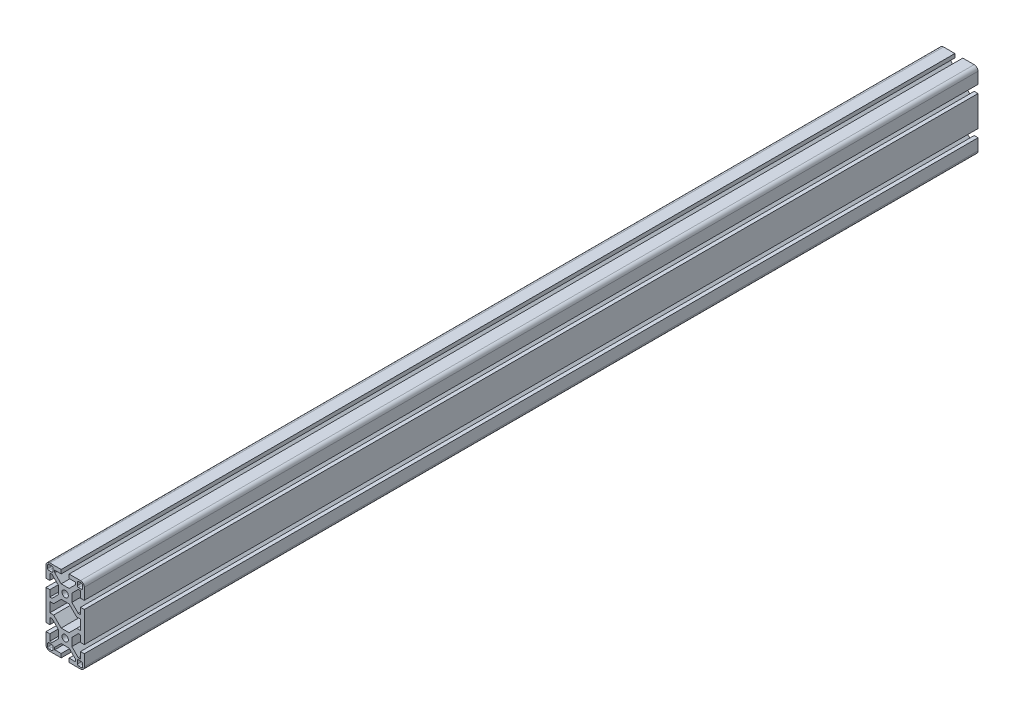
from build123d import *

# Parameters (mm, degrees)
SKETCH1_R                 = 2.45
BOSS_EXTRUDE1_DEPTH       = 700
SKETCH2_R                 = 3
CUT_EXTRUDE1_DEPTH        = 678.163200418
M6X1_0_TAPPED_HOLE1_D     = 5
M6X1_0_TAPPED_HOLE1_DEPTH = 28
M6X1_0_TAPPED_HOLE1_TIP   = 1.502151548
M6X1_0_TAPPED_HOLE2_D     = 5
M6X1_0_TAPPED_HOLE2_DEPTH = 28
M6X1_0_TAPPED_HOLE2_TIP   = 1.502151548


with BuildPart() as part:
    # Sketch1 → Boss-Extrude1 (new body)
    with BuildSketch(Plane.XY.offset(25)):
        with BuildLine():
            Line((10.271320344, -21.85), (12, -21.85))
            Line((12, -21.85), (12, -26.9))
            Line((12, -26.9), (15, -26.9))
            Line((15, -26.9), (15, -3.1))
            Line((15, -3.1), (12, -3.1))
            Line((12, -3.1), (12, -8.15))
            Line((12, -8.15), (10.271320344, -8.15))
            Line((10.271320344, -8.15), (5.25, -3.128679656))
            Line((5.25, -3.128679656), (5.25, 3.128679656))
            Line((5.25, 3.128679656), (10.271320344, 8.15))
            Line((10.271320344, 8.15), (12, 8.15))
            Line((12, 8.15), (12, 3.1))
            Line((12, 3.1), (15, 3.1))
            Line((15, 3.1), (15, 12))
            ThreePointArc((15, 12), (14.121320344, 14.121320344), (12, 15))
            Line((12, 15), (3.1, 15))
            Line((3.1, 15), (3.1, 12))
            Line((3.1, 12), (8.15, 12))
            Line((8.15, 12), (8.15, 10.271320344))
            Line((8.15, 10.271320344), (3.128679656, 5.25))
            Line((3.128679656, 5.25), (-3.128679656, 5.25))
            Line((-3.128679656, 5.25), (-8.15, 10.271320344))
            Line((-8.15, 10.271320344), (-8.15, 12))
            Line((-8.15, 12), (-3.1, 12))
            Line((-3.1, 12), (-3.1, 15))
            Line((-3.1, 15), (-12, 15))
            ThreePointArc((-12, 15), (-14.121320344, 14.121320344), (-15, 12))
            Line((-15, 12), (-15, 3.1))
            Line((-15, 3.1), (-12, 3.1))
            Line((-12, 3.1), (-12, 8.15))
            Line((-12, 8.15), (-10.271320344, 8.15))
            Line((-10.271320344, 8.15), (-5.25, 3.128679656))
            Line((-5.25, 3.128679656), (-5.25, -3.128679656))
            Line((-5.25, -3.128679656), (-10.271320344, -8.15))
            Line((-10.271320344, -8.15), (-12, -8.15))
            Line((-12, -8.15), (-12, -3.1))
            Line((-12, -3.1), (-15, -3.1))
            Line((-15, -3.1), (-15, -26.9))
            Line((-15, -26.9), (-12, -26.9))
            Line((-12, -26.9), (-12, -21.85))
            Line((-12, -21.85), (-10.271320344, -21.85))
            Line((-10.271320344, -21.85), (-5.25, -26.871320344))
            Line((-5.25, -26.871320344), (-5.25, -33.128679656))
            Line((-5.25, -33.128679656), (-10.271320344, -38.15))
            Line((-10.271320344, -38.15), (-12, -38.15))
            Line((-12, -38.15), (-12, -33.1))
            Line((-12, -33.1), (-15, -33.1))
            Line((-15, -33.1), (-15, -42))
            ThreePointArc((-15, -42), (-14.121320344, -44.121320344), (-12, -45))
            Line((-12, -45), (-3.1, -45))
            Line((-3.1, -45), (-3.1, -42))
            Line((-3.1, -42), (-8.15, -42))
            Line((-8.15, -42), (-8.15, -40.271320344))
            Line((-8.15, -40.271320344), (-3.128679656, -35.25))
            Line((-3.128679656, -35.25), (3.128679656, -35.25))
            Line((3.128679656, -35.25), (8.15, -40.271320344))
            Line((8.15, -40.271320344), (8.15, -42))
            Line((8.15, -42), (3.1, -42))
            Line((3.1, -42), (3.1, -45))
            Line((3.1, -45), (12, -45))
            ThreePointArc((12, -45), (14.121320344, -44.121320344), (15, -42))
            Line((15, -42), (15, -33.1))
            Line((15, -33.1), (12, -33.1))
            Line((12, -33.1), (12, -38.15))
            Line((12, -38.15), (10.271320344, -38.15))
            Line((10.271320344, -38.15), (5.25, -33.128679656))
            Line((5.25, -33.128679656), (5.25, -26.871320344))
            Line((5.25, -26.871320344), (10.271320344, -21.85))
        make_face()
        Circle(SKETCH1_R, mode=Mode.SUBTRACT)
        with Locations((0, -30)):
            Circle(SKETCH1_R, mode=Mode.SUBTRACT)
        with BuildLine():
            Line((-9.500000904, 12.700000174), (-9.500000904, 10.500000174))
            ThreePointArc((-9.500000904, 10.500000174), (-9.792894123, 9.792893393), (-10.500000904, 9.500000174))
            Line((-10.500000904, 9.500000174), (-12.700000904, 9.500000174))
            ThreePointArc((-12.700000904, 9.500000174), (-13.407107685, 9.792893393), (-13.700000904, 10.500000174))
            Line((-13.700000904, 10.500000174), (-13.700000904, 12.700000174))
            ThreePointArc((-13.700000904, 12.700000174), (-13.407107685, 13.407106955), (-12.700000904, 13.700000174))
            Line((-12.700000904, 13.700000174), (-10.500000904, 13.700000174))
            ThreePointArc((-10.500000904, 13.700000174), (-9.792894123, 13.407106955), (-9.500000904, 12.700000174))
        make_face(mode=Mode.SUBTRACT)
        with BuildLine():
            Line((12.700000904, 9.500000174), (10.500000904, 9.500000174))
            ThreePointArc((10.500000904, 9.500000174), (9.792894123, 9.792893393), (9.500000904, 10.500000174))
            Line((9.500000904, 10.500000174), (9.500000904, 12.700000174))
            ThreePointArc((9.500000904, 12.700000174), (9.792894123, 13.407106955), (10.500000904, 13.700000174))
            Line((10.500000904, 13.700000174), (12.700000904, 13.700000174))
            ThreePointArc((12.700000904, 13.700000174), (13.407107685, 13.407106955), (13.700000904, 12.700000174))
            Line((13.700000904, 12.700000174), (13.700000904, 10.500000174))
            ThreePointArc((13.700000904, 10.500000174), (13.407107685, 9.792893393), (12.700000904, 9.500000174))
        make_face(mode=Mode.SUBTRACT)
        with BuildLine():
            Line((-12.700000904, -39.500000174), (-10.500000904, -39.500000174))
            ThreePointArc((-10.500000904, -39.500000174), (-9.792894123, -39.792893393), (-9.500000904, -40.500000174))
            Line((-9.500000904, -40.500000174), (-9.500000904, -42.700000174))
            ThreePointArc((-9.500000904, -42.700000174), (-9.792894123, -43.407106955), (-10.500000904, -43.700000174))
            Line((-10.500000904, -43.700000174), (-12.700000904, -43.700000174))
            ThreePointArc((-12.700000904, -43.700000174), (-13.407107685, -43.407106955), (-13.700000904, -42.700000174))
            Line((-13.700000904, -42.700000174), (-13.700000904, -40.500000174))
            ThreePointArc((-13.700000904, -40.500000174), (-13.407107685, -39.792893393), (-12.700000904, -39.500000174))
        make_face(mode=Mode.SUBTRACT)
        with BuildLine():
            Line((9.500000904, -42.700000174), (9.500000904, -40.500000174))
            ThreePointArc((9.500000904, -40.500000174), (9.792894123, -39.792893393), (10.500000904, -39.500000174))
            Line((10.500000904, -39.500000174), (12.700000904, -39.500000174))
            ThreePointArc((12.700000904, -39.500000174), (13.407107685, -39.792893393), (13.700000904, -40.500000174))
            Line((13.700000904, -40.500000174), (13.700000904, -42.700000174))
            ThreePointArc((13.700000904, -42.700000174), (13.407107685, -43.407106955), (12.700000904, -43.700000174))
            Line((12.700000904, -43.700000174), (10.500000904, -43.700000174))
            ThreePointArc((10.500000904, -43.700000174), (9.792894123, -43.407106955), (9.500000904, -42.700000174))
        make_face(mode=Mode.SUBTRACT)
        Polygon((3.128679656, -24.75), (9.028679656, -18.85), (12, -18.85), (12, -11.15), (9.028679656, -11.15), (3.128679656, -5.25), (-3.128679656, -5.25), (-9.028679656, -11.15), (-12, -11.15), (-12, -18.85), (-9.028679656, -18.85), (-3.128679656, -24.75), align=None, mode=Mode.SUBTRACT)
    extrude(amount=-BOSS_EXTRUDE1_DEPTH)

    # Sketch2 → Cut-Extrude1 (cut, through all)
    with BuildSketch(Plane(origin=(15, 0, 0), x_dir=(0, 0, -1), z_dir=(1, 0, 0))):
        with Locations((30, -30)):
            Circle(SKETCH2_R)
    extrude(amount=-CUT_EXTRUDE1_DEPTH, mode=Mode.SUBTRACT)

    # M6x1.0 Tapped Hole1
    with Locations(Plane.XY.offset(25)):
        with Locations((0, 0), (0, -30)):
            Hole(M6X1_0_TAPPED_HOLE1_D / 2, depth=M6X1_0_TAPPED_HOLE1_DEPTH)
            with Locations((0, 0, -(M6X1_0_TAPPED_HOLE1_DEPTH + M6X1_0_TAPPED_HOLE1_TIP / 2))):  # 118° drill point
                Cone(0, M6X1_0_TAPPED_HOLE1_D / 2, M6X1_0_TAPPED_HOLE1_TIP, mode=Mode.SUBTRACT)

    # M6x1.0 Tapped Hole2
    with Locations(Plane(origin=(0, 0, -675), x_dir=(-1, 0, 0), z_dir=(0, 0, -1))):
        with Locations((0, 0), (0, -30)):
            Hole(M6X1_0_TAPPED_HOLE2_D / 2, depth=M6X1_0_TAPPED_HOLE2_DEPTH)
            with Locations((0, 0, -(M6X1_0_TAPPED_HOLE2_DEPTH + M6X1_0_TAPPED_HOLE2_TIP / 2))):  # 118° drill point
                Cone(0, M6X1_0_TAPPED_HOLE2_D / 2, M6X1_0_TAPPED_HOLE2_TIP, mode=Mode.SUBTRACT)


solid = part.part
